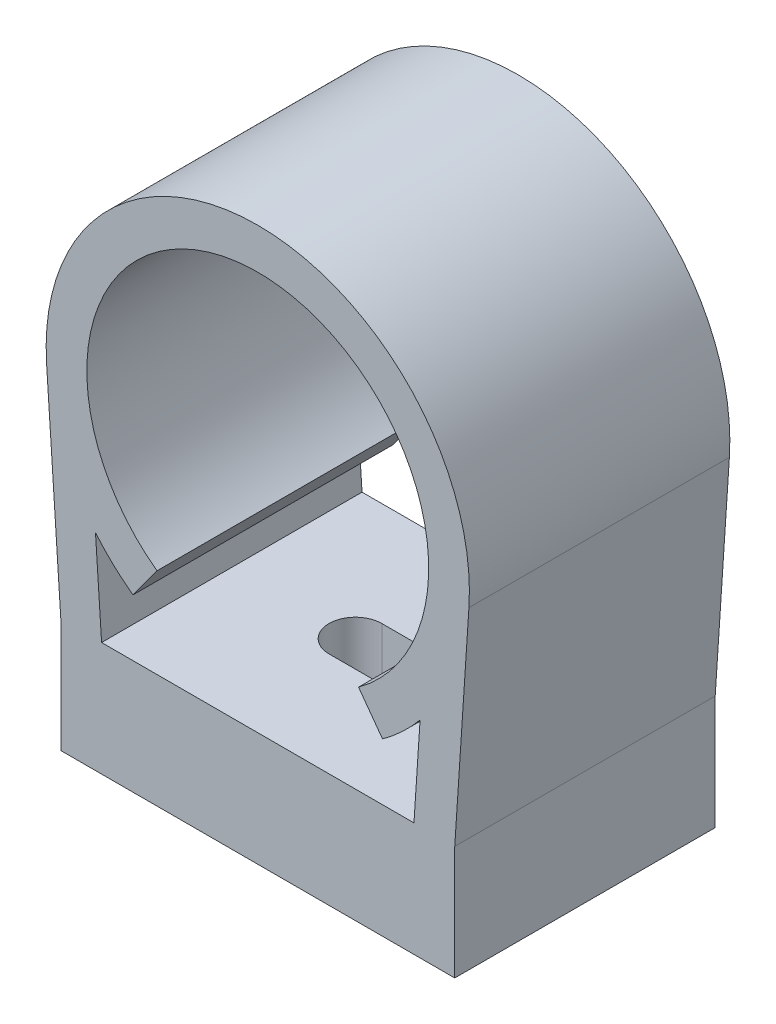
from build123d import *

# Parameters (mm, degrees)
BOSS_EXTRUDE1_DEPTH = 20.32
CUT_EXTRUDE1_REACH  = 59.39


with BuildPart() as part:
    # Sketch1 → Boss-Extrude1 (new body)
    with BuildSketch(Plane.XY):
        with BuildLine():
            Line((0, 0), (30.734, 0))
            Line((30.734, 0), (30.734, 8.89))
            Line((30.734, 8.89), (31.840804573, 25.577359666))
            ThreePointArc((31.840804573, 25.577359666), (15.367, 43.18), (-1.106804573, 25.577359666))
            Line((-1.106804573, 25.577359666), (0, 8.89))
            Line((0, 8.89), (0, 0))
        make_face()
        with BuildLine():
            Line((3.181975953, 8.89), (27.552024047, 8.89))
            Line((27.552024047, 8.89), (28.02853988, 16.074458114))
            ThreePointArc((28.02853988, 16.074458114), (26.648414098, 14.615548708), (25.10136567, 13.335))
            Line((25.10136567, 13.335), (23.229372272, 15.899423077))
            ThreePointArc((23.229372272, 15.899423077), (15.367, 40.005), (7.504627728, 15.899423077))
            Line((7.504627728, 15.899423077), (5.63263433, 13.335))
            ThreePointArc((5.63263433, 13.335), (4.085585902, 14.615548708), (2.70546012, 16.074458114))
            Line((2.70546012, 16.074458114), (3.181975953, 8.89))
        make_face(mode=Mode.SUBTRACT)
    extrude(amount=BOSS_EXTRUDE1_DEPTH)

    # Sketch2 → Cut-Extrude1 (cut, up to next)
    with BuildSketch(Plane.XZ, mode=Mode.PRIVATE) as cut_extrude1_sk1:
        with BuildLine():
            Line((12.827, 12.2174), (17.907, 12.2174))
            ThreePointArc((17.907, 12.2174), (19.9644, 10.16), (17.907, 8.1026))
            Line((17.907, 8.1026), (12.827, 8.1026))
            ThreePointArc((12.827, 8.1026), (10.7696, 10.16), (12.827, 12.2174))
        make_face()
    cut_extrude1_tool1 = extrude(cut_extrude1_sk1.sketch, amount=-CUT_EXTRUDE1_REACH, mode=Mode.PRIVATE) & part.part
    add(cut_extrude1_tool1.solids().sort_by_distance((15.367, 0, 10.16))[0], mode=Mode.SUBTRACT)


solid = part.part
